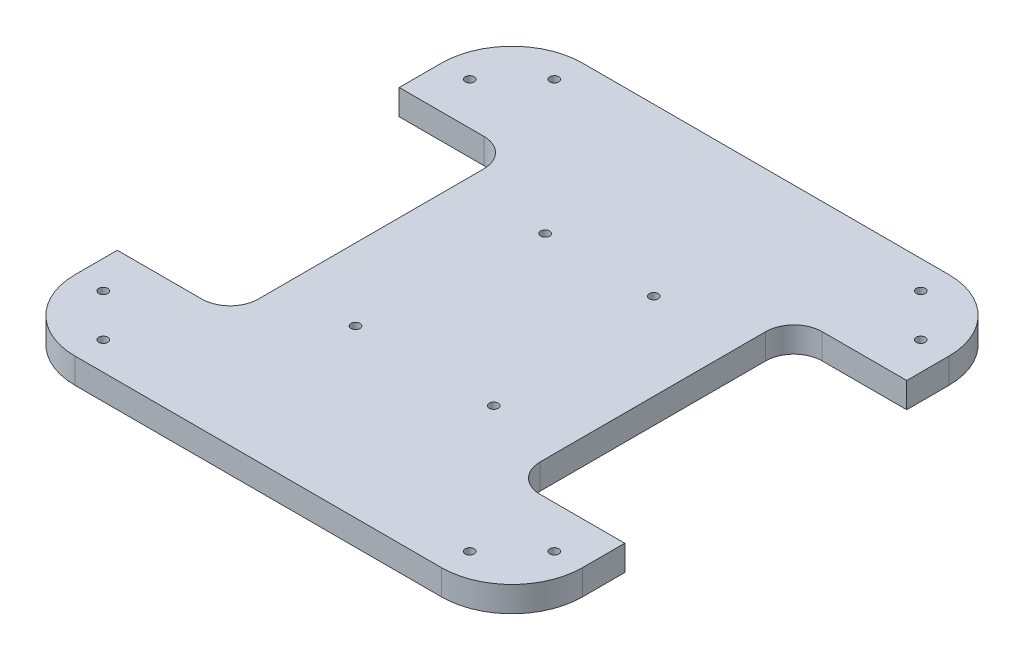
from build123d import *

# Parameters (mm, degrees)
PLATE_DEPTH         = 9
SKETCH3_R           = 1.6
HEX_HOLES_DEPTH     = 128.597021909
SKETCH4_R           = 1.6
ARDUINO_HOLES_DEPTH = 128.597021909
SKETCH5_W           = 40
SKETCH5_H           = 100
CUT_EXTRUDE1_DEPTH  = 128.597021909
FILLET1_R           = 10


with BuildPart() as part:
    # Sketch1 → Plate (new body)
    with BuildSketch(Plane(origin=(0, 0, 0), x_dir=(1, 0, 0), z_dir=(0, 1, 0))):
        with BuildLine():
            Line((-65, -90), (65, -90))
            ThreePointArc((65, -90), (82.67766953, -82.67766953), (90, -65))
            Line((90, -65), (90, 65))
            ThreePointArc((90, 65), (82.67766953, 82.67766953), (65, 90))
            Line((65, 90), (-65, 90))
            ThreePointArc((-65, 90), (-82.67766953, 82.67766953), (-90, 65))
            Line((-90, 65), (-90, -65))
            ThreePointArc((-90, -65), (-82.67766953, -82.67766953), (-65, -90))
        make_face()
    extrude(amount=PLATE_DEPTH)

    # Sketch3 → Hex Holes (cut, through all)
    with BuildSketch(Plane(origin=(0, 9, 0), x_dir=(1, 0, 0), z_dir=(0, 1, 0))):
        with Locations(Location((-65, 80, 0), (0, 0, 270))):
            Circle(SKETCH3_R)
        with Locations(Location((-80, 65, 0), (0, 0, 270))):
            Circle(SKETCH3_R)
        with Locations(Location((80, 65, 0), (0, 0, 270))):
            Circle(SKETCH3_R)
        with Locations(Location((80, -65, 0), (0, 0, 270))):
            Circle(SKETCH3_R)
        with Locations(Location((65, 80, 0), (0, 0, 270))):
            Circle(SKETCH3_R)
        with Locations(Location((65, -80, 0), (0, 0, 270))):
            Circle(SKETCH3_R)
        with Locations(Location((-65, -80, 0), (0, 0, 270))):
            Circle(SKETCH3_R)
        with Locations(Location((-80, -65, 0), (0, 0, 270))):
            Circle(SKETCH3_R)
    extrude(amount=-HEX_HOLES_DEPTH, mode=Mode.SUBTRACT)

    # Sketch4 → Arduino Holes (cut, through all)
    with BuildSketch(Plane(origin=(0, 9, 0), x_dir=(1, 0, 0), z_dir=(0, 1, 0))):
        with Locations(Location((-24.5, -31, 0), (0, 0, 270))):
            Circle(SKETCH4_R)
        with Locations(Location((24.5, -31, 0), (0, 0, 270))):
            Circle(SKETCH4_R)
        with Locations(Location((-19.25, 31, 0), (0, 0, 270))):
            Circle(SKETCH4_R)
        with Locations(Location((19.25, 31, 0), (0, 0, 270))):
            Circle(SKETCH4_R)
    extrude(amount=-ARDUINO_HOLES_DEPTH, mode=Mode.SUBTRACT)

    # Sketch5 → Cut-Extrude1 (cut, through all)
    with BuildSketch(Plane(origin=(0, 9, 0), x_dir=(1, 0, 0), z_dir=(0, 1, 0))):
        with Locations((-70, 0)):
            Rectangle(SKETCH5_W, SKETCH5_H)
        with Locations((70, 0)):
            Rectangle(SKETCH5_W, SKETCH5_H)
    extrude(amount=-CUT_EXTRUDE1_DEPTH, mode=Mode.SUBTRACT)

    # Fillet1
    fillet1_edges = [part.edges().sort_by_distance(p)[0] for p in [
        (50, 4.5, 50),
        (50, 4.5, -50),
        (-50, 4.5, -50),
        (-50, 4.5, 50),
    ]]
    fillet(fillet1_edges, radius=FILLET1_R)


solid = part.part
